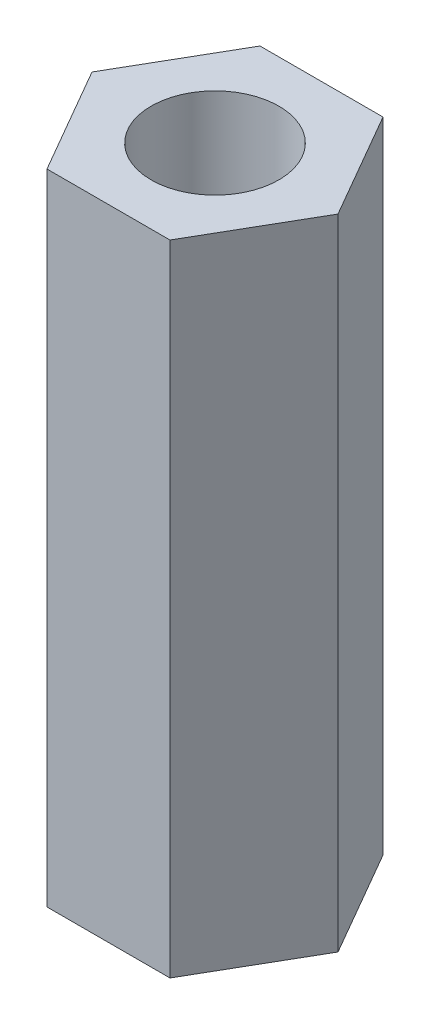
from build123d import *

# Parameters (mm, degrees)
CROQUIS1_R              = 1.5
SALIENTE_EXTRUIR1_DEPTH = 7.5


with BuildPart() as part:
    # Croquis1 → Saliente-Extruir1 (new, symmetric)
    with BuildSketch(Plane(origin=(0, 0, 0), x_dir=(1, 0, 0), z_dir=(0, 1, 0))):
        Polygon((1.443375673, -2.5), (2.886751346, 0), (1.443375673, 2.5), (-1.443375673, 2.5), (-2.886751346, 0), (-1.443375673, -2.5), align=None)
        with Locations(Location((0, 0, 0), (0, 0, 270))):
            Circle(CROQUIS1_R, mode=Mode.SUBTRACT)
    extrude(amount=SALIENTE_EXTRUIR1_DEPTH, both=True)


solid = part.part
